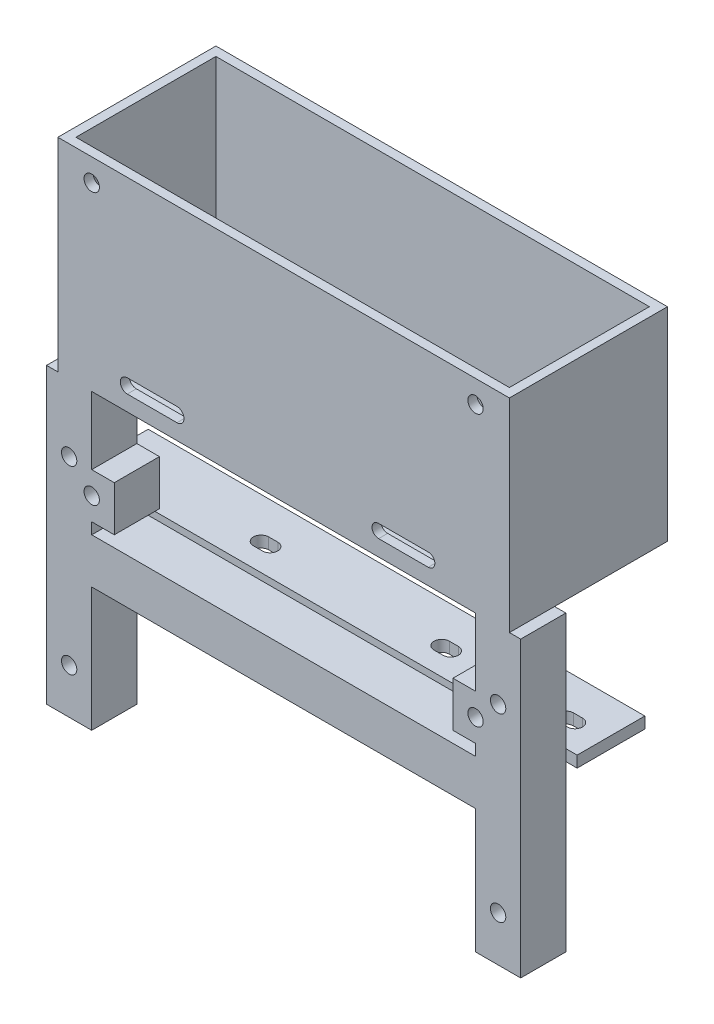
from build123d import *

# Parameters (mm, degrees)
V3_BOX_FOOTPRINT_100_X_45_MM_W                 = 100
V3_BOX_FOOTPRINT_100_X_45_MM_H                 = 45
V3_BOX_HEIGHT_35_MM_DEPTH                      = 35
V3_REAR_OPENING_96_X_31_MM_W                   = 96
V3_REAR_OPENING_96_X_31_MM_H                   = 31
V3_CAVITY_ALL_WALLS_2_MM_DEPTH                 = 43
V3_SQUARE_BEAMS_10_X_10_PITCH_95_MM_W          = 10
V3_SQUARE_BEAMS_10_X_10_PITCH_95_MM_H          = 10
V3_FORWARD_BEAM_LENGTH_65_MM_DEPTH             = 65
V3_LEFT_PCB_EAR_PROFILE_W                      = 10
V3_LEFT_PCB_EAR_PROFILE_H                      = 10
V3_LEFT_INWARD_EAR_5_MM_DEPTH                  = 5
V3_RIGHT_PCB_EAR_PROFILE_W                     = 10
V3_RIGHT_PCB_EAR_PROFILE_H                     = 10
V3_RIGHT_INWARD_EAR_5_MM_DEPTH                 = 5
V3_PCB_ROOF_PAIR_PITCH_85_MM_R                 = 1.7
V3_M3_ROOF_HOLES_DIAMETER_3_4_MM_DEPTH         = 2
V3_PCB_FORWARD_PAIR_ROW_SPACING_60_MM_R        = 1.7
V3_M3_PCB_EAR_HOLES_DEPTH                      = 10
V3_CHASSIS_TOP_HOLES_WIDTH_95_DEPTH_40_M_R     = 1.7
V3_M3_BEAM_TOP_BOTTOM_HOLES_DEPTH              = 10
V3_HANGING_PLATE_OFFSET_26_THICKNESS_2_5_W     = 110
V3_HANGING_PLATE_OFFSET_26_THICKNESS_2_5_H     = 2.5
V3_MOUNTING_PLATE_DOWNWARD_15_MM_WIDTH_1_DEPTH = 15
FOUR_HORIZONTAL_SLOTS_3_4_X_5_4_MM_DEPTH       = 2.5
CUT_EXTRUDE_1_DEPTH                            = 93.059763198
H_CROSSMEMBER_10_X_10_MM_AT_BEAM_MIDPOIN_W     = 10
H_CROSSMEMBER_10_X_10_MM_AT_BEAM_MIDPOIN_H     = 10
H_CROSSMEMBER_85_MM_DEPTH                      = 85
LONGITUDINAL_START                             = -2
BEAM_CAVITIES_6_MM_WIDE_PRESERVING_SCREW_W     = 6
BEAM_CAVITIES_6_MM_WIDE_PRESERVING_SCREW_H     = 6
BEAM_CAVITIES_6_MM_WIDE_PRESERVING_SCREW_H_2   = 27
BEAM_CAVITIES_6_MM_WIDE_PRESERVING_SCREW_H_3   = 9
LONGITUDINAL_BEAM_WALLS_2_MM_INNER_HEI_DEPTH   = 6
H_START                                        = -2
H_CROSSMEMBER_CAVITY_CONNECTS_BOTH_BEAM_W      = 89
H_CROSSMEMBER_CAVITY_CONNECTS_BOTH_BEAM_H      = 6
H_CROSSMEMBER_WALLS_2_MM_DEPTH                 = 6


with BuildPart() as part:
    # V3 box footprint 100 x 45 mm → V3 box height 35 mm (new body)
    with BuildSketch(Plane.XY):
        with Locations((0, 22.5)):
            Rectangle(V3_BOX_FOOTPRINT_100_X_45_MM_W, V3_BOX_FOOTPRINT_100_X_45_MM_H)
    extrude(amount=V3_BOX_HEIGHT_35_MM_DEPTH)

    # V3 rear opening 96 x 31 mm → V3 cavity all walls 2 mm (cut)
    with BuildSketch(Plane(origin=(0, 45, 0), x_dir=(1, 0, 0), z_dir=(0, 1, 0))):
        with Locations((0, -17.5)):
            Rectangle(V3_REAR_OPENING_96_X_31_MM_W, V3_REAR_OPENING_96_X_31_MM_H)
    extrude(amount=-V3_CAVITY_ALL_WALLS_2_MM_DEPTH, mode=Mode.SUBTRACT)

    # V3 square beams 10 x 10 pitch 95 mm → V3 forward beam length 65 mm (add)
    with BuildSketch(Plane.XZ):
        with Locations((-47.5, 30)):
            Rectangle(V3_SQUARE_BEAMS_10_X_10_PITCH_95_MM_W, V3_SQUARE_BEAMS_10_X_10_PITCH_95_MM_H)
        with Locations((47.5, 30)):
            Rectangle(V3_SQUARE_BEAMS_10_X_10_PITCH_95_MM_W, V3_SQUARE_BEAMS_10_X_10_PITCH_95_MM_H)
    extrude(amount=V3_FORWARD_BEAM_LENGTH_65_MM_DEPTH)

    # V3 left PCB ear profile → V3 left inward ear 5 mm (add)
    with BuildSketch(Plane(origin=(-42.5, 0, 0), x_dir=(0, 0, -1), z_dir=(1, 0, 0))):
        with Locations((-30, -20)):
            Rectangle(V3_LEFT_PCB_EAR_PROFILE_W, V3_LEFT_PCB_EAR_PROFILE_H)
    extrude(amount=V3_LEFT_INWARD_EAR_5_MM_DEPTH)

    # V3 right PCB ear profile → V3 right inward ear 5 mm (add)
    with BuildSketch(Plane.ZY.offset(-42.5)):
        with Locations((30, -20)):
            Rectangle(V3_RIGHT_PCB_EAR_PROFILE_W, V3_RIGHT_PCB_EAR_PROFILE_H)
    extrude(amount=V3_RIGHT_INWARD_EAR_5_MM_DEPTH)

    # V3 PCB roof pair pitch 85 mm → V3 M3 roof holes diameter 3.4 mm (cut)
    with BuildSketch(Plane.XY.offset(35)):
        with Locations((-42.5, 40)):
            Circle(V3_PCB_ROOF_PAIR_PITCH_85_MM_R)
        with Locations((42.5, 40)):
            Circle(V3_PCB_ROOF_PAIR_PITCH_85_MM_R)
    extrude(amount=-V3_M3_ROOF_HOLES_DIAMETER_3_4_MM_DEPTH, mode=Mode.SUBTRACT)

    # V3 PCB forward pair row spacing 60 mm → V3 M3 PCB ear holes (cut)
    with BuildSketch(Plane.XY.offset(35)):
        with Locations((-42.5, -20)):
            Circle(V3_PCB_FORWARD_PAIR_ROW_SPACING_60_MM_R)
        with Locations((42.5, -20)):
            Circle(V3_PCB_FORWARD_PAIR_ROW_SPACING_60_MM_R)
    extrude(amount=-V3_M3_PCB_EAR_HOLES_DEPTH, mode=Mode.SUBTRACT)

    # V3 chassis top holes width 95 depth 40 mm → V3 M3 beam top bottom holes (cut)
    with BuildSketch(Plane.XY.offset(35)):
        with Locations((-47.5, -55)):
            Circle(V3_CHASSIS_TOP_HOLES_WIDTH_95_DEPTH_40_M_R)
        with Locations((-47.5, -15)):
            Circle(V3_CHASSIS_TOP_HOLES_WIDTH_95_DEPTH_40_M_R)
        with Locations((47.5, -55)):
            Circle(V3_CHASSIS_TOP_HOLES_WIDTH_95_DEPTH_40_M_R)
        with Locations((47.5, -15)):
            Circle(V3_CHASSIS_TOP_HOLES_WIDTH_95_DEPTH_40_M_R)
    extrude(amount=-V3_M3_BEAM_TOP_BOTTOM_HOLES_DEPTH, mode=Mode.SUBTRACT)

    # V3 hanging plate offset 26 thickness 2.5 mm → V3 mounting plate downward 15 mm width 110 (add)
    with BuildSketch(Plane(origin=(0, 0, 25), x_dir=(-1, 0, 0), z_dir=(0, 0, -1))):
        with Locations((0, -27.25)):
            Rectangle(V3_HANGING_PLATE_OFFSET_26_THICKNESS_2_5_W, V3_HANGING_PLATE_OFFSET_26_THICKNESS_2_5_H)
    extrude(amount=V3_MOUNTING_PLATE_DOWNWARD_15_MM_WIDTH_1_DEPTH)

    # V3 slots 6 mm below beam underside centers 20 and 47.5 → Four horizontal slots 3.4 x 5.4 mm (cut)
    with BuildSketch(Plane.XZ.offset(28.5)):
        with BuildLine():
            Line((-48.5, 20.7), (-46.5, 20.7))
            ThreePointArc((-46.5, 20.7), (-44.8, 19), (-46.5, 17.3))
            Line((-46.5, 17.3), (-48.5, 17.3))
            ThreePointArc((-48.5, 17.3), (-50.2, 19), (-48.5, 20.7))
        make_face()
        with BuildLine():
            Line((-21, 20.7), (-19, 20.7))
            ThreePointArc((-19, 20.7), (-17.3, 19), (-19, 17.3))
            Line((-19, 17.3), (-21, 17.3))
            ThreePointArc((-21, 17.3), (-22.7, 19), (-21, 20.7))
        make_face()
        with BuildLine():
            Line((19, 20.7), (21, 20.7))
            ThreePointArc((21, 20.7), (22.7, 19), (21, 17.3))
            Line((21, 17.3), (19, 17.3))
            ThreePointArc((19, 17.3), (17.3, 19), (19, 20.7))
        make_face()
        with BuildLine():
            Line((46.5, 20.7), (48.5, 20.7))
            ThreePointArc((48.5, 20.7), (50.2, 19), (48.5, 17.3))
            Line((48.5, 17.3), (46.5, 17.3))
            ThreePointArc((46.5, 17.3), (44.8, 19), (46.5, 20.7))
        make_face()
    extrude(amount=-FOUR_HORIZONTAL_SLOTS_3_4_X_5_4_MM_DEPTH, mode=Mode.SUBTRACT)

    # 草图2 → 切除-拉伸1 (cut, through all)
    with BuildSketch(Plane(origin=(0, 0, 0), x_dir=(-1, 0, 0), z_dir=(0, 0, -1))):
        with BuildLine():
            Line((-32.029979042, 6.459471041), (-21.029979042, 6.459471041))
            ThreePointArc((-21.029979042, 6.459471041), (-19.570508001, 5), (-21.029979042, 3.540528959))
            Line((-21.029979042, 3.540528959), (-32.029979042, 3.540528959))
            ThreePointArc((-32.029979042, 3.540528959), (-33.489450083, 5), (-32.029979042, 6.459471041))
        make_face()
        with BuildLine():
            Line((23.620107008, 6.558669056), (34.620107008, 6.558669056))
            ThreePointArc((34.620107008, 6.558669056), (36.178776063, 5), (34.620107008, 3.441330944))
            Line((34.620107008, 3.441330944), (23.620107008, 3.441330944))
            ThreePointArc((23.620107008, 3.441330944), (22.061437952, 5), (23.620107008, 6.558669056))
        make_face()
    extrude(amount=-CUT_EXTRUDE_1_DEPTH, mode=Mode.SUBTRACT)

    # H crossmember 10 x 10 mm at beam midpoint → H crossmember 85 mm (add)
    with BuildSketch(Plane(origin=(-42.5, 0, 0), x_dir=(0, 0, -1), z_dir=(1, 0, 0))):
        with Locations((-30, -32.5)):
            Rectangle(H_CROSSMEMBER_10_X_10_MM_AT_BEAM_MIDPOIN_W, H_CROSSMEMBER_10_X_10_MM_AT_BEAM_MIDPOIN_H)
    extrude(amount=H_CROSSMEMBER_85_MM_DEPTH)

    # Beam cavities 6 mm wide preserving screw collars → Longitudinal beam walls 2 mm - inner height 6 mm (cut)
    with BuildSketch(Plane.XY.offset(35).offset(LONGITUDINAL_START)):
        with Locations((-47.5, -62)):
            Rectangle(BEAM_CAVITIES_6_MM_WIDE_PRESERVING_SCREW_W, BEAM_CAVITIES_6_MM_WIDE_PRESERVING_SCREW_H)
        with Locations((-47.5, -37.5)):
            Rectangle(BEAM_CAVITIES_6_MM_WIDE_PRESERVING_SCREW_W, BEAM_CAVITIES_6_MM_WIDE_PRESERVING_SCREW_H_2)
        with Locations((-47.5, -6.5)):
            Rectangle(BEAM_CAVITIES_6_MM_WIDE_PRESERVING_SCREW_W, BEAM_CAVITIES_6_MM_WIDE_PRESERVING_SCREW_H_3)
        with Locations((47.5, -62)):
            Rectangle(BEAM_CAVITIES_6_MM_WIDE_PRESERVING_SCREW_W, BEAM_CAVITIES_6_MM_WIDE_PRESERVING_SCREW_H)
        with Locations((47.5, -37.5)):
            Rectangle(BEAM_CAVITIES_6_MM_WIDE_PRESERVING_SCREW_W, BEAM_CAVITIES_6_MM_WIDE_PRESERVING_SCREW_H_2)
        with Locations((47.5, -6.5)):
            Rectangle(BEAM_CAVITIES_6_MM_WIDE_PRESERVING_SCREW_W, BEAM_CAVITIES_6_MM_WIDE_PRESERVING_SCREW_H_3)
    extrude(amount=-LONGITUDINAL_BEAM_WALLS_2_MM_INNER_HEI_DEPTH, mode=Mode.SUBTRACT)

    # H crossmember cavity connects both beam cavities → H crossmember walls 2 mm (cut)
    with BuildSketch(Plane.XY.offset(35).offset(H_START)):
        with Locations((0, -32.5)):
            Rectangle(H_CROSSMEMBER_CAVITY_CONNECTS_BOTH_BEAM_W, H_CROSSMEMBER_CAVITY_CONNECTS_BOTH_BEAM_H)
    extrude(amount=-H_CROSSMEMBER_WALLS_2_MM_DEPTH, mode=Mode.SUBTRACT)


solid = part.part
